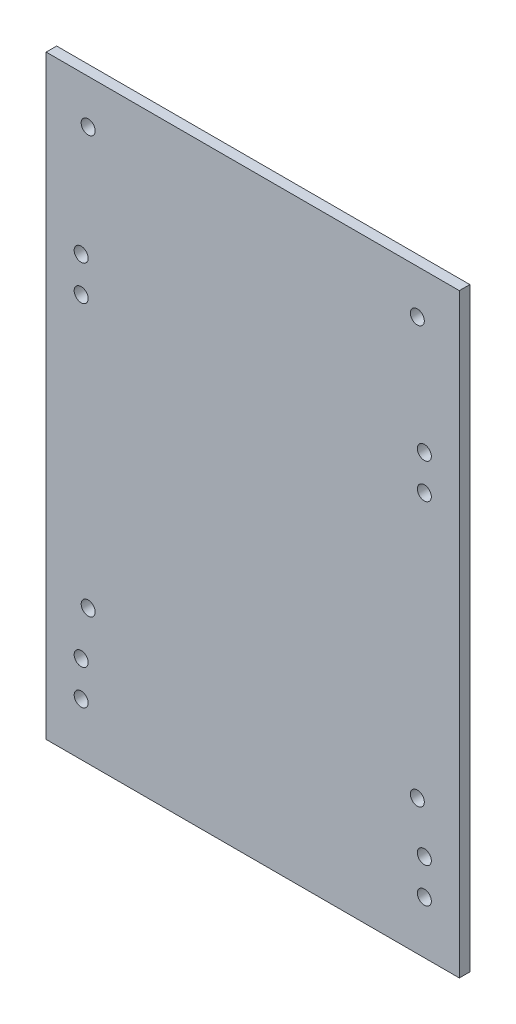
from build123d import *

# Parameters (mm, degrees)
SKETCH_1_W      = 118
SKETCH_1_H      = 170
SKETCH_1_R      = 2
EXTRUDE_1_DEPTH = 3


with BuildPart() as part:
    # 草图1 → 凸台-拉伸1 (new body)
    with BuildSketch(Plane.XY):
        with Locations((0, 15)):
            Rectangle(SKETCH_1_W, SKETCH_1_H)
        with Locations((-49, 55)):
            Circle(SKETCH_1_R, mode=Mode.SUBTRACT)
        with Locations((-49, 45)):
            Circle(SKETCH_1_R, mode=Mode.SUBTRACT)
        with Locations(Location((49, 45, 0), (0, 0, 180))):
            Circle(SKETCH_1_R, mode=Mode.SUBTRACT)
        with Locations(Location((49, 55, 0), (0, 0, 180))):
            Circle(SKETCH_1_R, mode=Mode.SUBTRACT)
        with Locations((49, -45)):
            Circle(SKETCH_1_R, mode=Mode.SUBTRACT)
        with Locations((49, -55)):
            Circle(SKETCH_1_R, mode=Mode.SUBTRACT)
        with Locations(Location((-49, -45, 0), (0, 0, 180))):
            Circle(SKETCH_1_R, mode=Mode.SUBTRACT)
        with Locations(Location((-49, -55, 0), (0, 0, 180))):
            Circle(SKETCH_1_R, mode=Mode.SUBTRACT)
        with Locations((-47, 87.5)):
            Circle(SKETCH_1_R, mode=Mode.SUBTRACT)
        with Locations(Location((47, 87.5, 0), (0, 0, 180))):
            Circle(SKETCH_1_R, mode=Mode.SUBTRACT)
        with Locations((47, -31.5)):
            Circle(SKETCH_1_R, mode=Mode.SUBTRACT)
        with Locations(Location((-47, -31.5, 0), (0, 0, 180))):
            Circle(SKETCH_1_R, mode=Mode.SUBTRACT)
    extrude(amount=EXTRUDE_1_DEPTH)


solid = part.part
